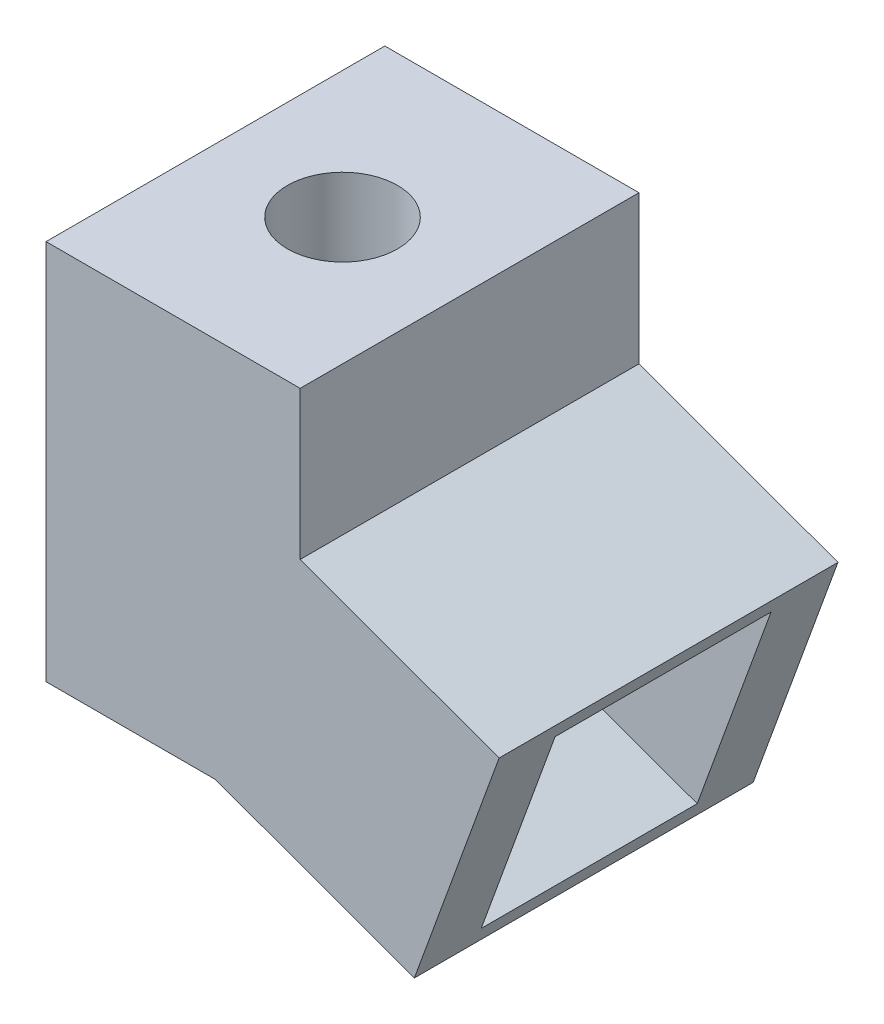
from build123d import *

# Parameters (mm, degrees)
SKETCH_1_W          = 15
SKETCH_1_H          = 5
SKETCH_1_R          = 0.85
EXTRUDE_1_DEPTH     = 2
SKETCH_2_W          = 6
SKETCH_2_H          = 8
EXTRUDE_3_DEPTH     = 6
CUT_EXTRUDE_2_DEPTH = 8
SKETCH_7_W          = 5.1
SKETCH_7_H          = 5.1
CUT_EXTRUDE_3_DEPTH = 2
SKETCH_10_W         = 8
SKETCH_10_H         = 5.852977749
SKETCH_10_W_2       = 5.1
SKETCH_10_H_2       = 5.1
EXTRUDE_4_DEPTH     = 5
SKETCH_11_W         = 6
SKETCH_11_H         = 8
EXTRUDE_5_DEPTH     = 3
CUT_EXTRUDE_4_DEPTH = 5
SKETCH_13_W         = 4.5
SKETCH_13_H         = 5
CUT_EXTRUDE_5_DEPTH = 2


with BuildPart() as part:
    # 草图1 → 凸台-拉伸1 (new body)
    with BuildSketch(Plane(origin=(0, 0, 0), x_dir=(1, 0, 0), z_dir=(0, 1, 0))):
        with Locations((7.5, 2.5)):
            Rectangle(SKETCH_1_W, SKETCH_1_H)
        with Locations(Location((3.25, 2.5, 0), (0, 0, 270))):
            Circle(SKETCH_1_R, mode=Mode.SUBTRACT)
        with Locations(Location((11.75, 2.5, 0), (0, 0, 90))):
            Circle(SKETCH_1_R, mode=Mode.SUBTRACT)
    extrude(amount=EXTRUDE_1_DEPTH)

    # 草图2 → 凸台-拉伸3 (add)
    with BuildSketch(Plane.XZ):
        with Locations((7.5, -2.5)):
            Rectangle(SKETCH_2_W, SKETCH_2_H)
    extrude(amount=EXTRUDE_3_DEPTH)

    # 草图6 → 切除-拉伸2 (cut)
    with BuildSketch(Plane(origin=(0, 0, -6.5), x_dir=(-1, 0, 0), z_dir=(0, 0, -1))):
        Polygon((-10.5, -0.5), (-10.5, -6), (-8.498163712, -6), align=None)
    extrude(amount=-CUT_EXTRUDE_2_DEPTH, mode=Mode.SUBTRACT)

    # 草图7 → 切除-拉伸3 (cut)
    with BuildSketch(Plane(origin=(9.432430229, -3.43312384, 0), x_dir=(0, 0, -1), z_dir=(0.9396926207859104, -0.3420201433256631, 0))):
        with Locations((2.5, 0.19487632)):
            Rectangle(SKETCH_7_W, SKETCH_7_H)
    extrude(amount=-CUT_EXTRUDE_3_DEPTH, mode=Mode.SUBTRACT)

    # 草图10 → 凸台-拉伸4 (add)
    with BuildSketch(Plane(origin=(9.432430229, -3.43312384, 0), x_dir=(0, 0, -1), z_dir=(0.9396926207859104, -0.3420201433256631, 0))):
        with Locations((2.5, 0.19487632)):
            Rectangle(SKETCH_10_W, SKETCH_10_H)
        with Locations((2.5, 0.19487632)):
            Rectangle(SKETCH_10_W_2, SKETCH_10_H_2, mode=Mode.SUBTRACT)
    extrude(amount=EXTRUDE_4_DEPTH)

    # 草图11 → 凸台-拉伸5 (add)
    with BuildSketch(Plane(origin=(0, 0, 0), x_dir=(1, 0, 0), z_dir=(0, 1, 0))):
        with Locations((7.5, 2.5)):
            Rectangle(SKETCH_11_W, SKETCH_11_H)
    extrude(amount=EXTRUDE_5_DEPTH)

    # 草图12 → 切除-拉伸4 (cut)
    with BuildSketch(Plane(origin=(0, 3, 0), x_dir=(1, 0, 0), z_dir=(0, 1, 0))):
        with BuildLine():
            ThreePointArc((8.8, 2.5), (7.5, 3.8), (6.2, 2.5))
            Line((6.2, 2.5), (8.8, 2.5))
        make_face()
        with BuildLine():
            Line((8.8, 2.5), (6.2, 2.5))
            ThreePointArc((6.2, 2.5), (7.5, 1.2), (8.8, 2.5))
        make_face()
    extrude(amount=-CUT_EXTRUDE_4_DEPTH, mode=Mode.SUBTRACT)

    # 草图13 → 切除-拉伸5 (cut)
    with BuildSketch(Plane(origin=(0, 2, 0), x_dir=(1, 0, 0), z_dir=(0, 1, 0))):
        with Locations((2.25, 2.5)):
            Rectangle(SKETCH_13_W, SKETCH_13_H)
        with Locations((12.75, 2.5)):
            Rectangle(SKETCH_13_W, SKETCH_13_H)
    extrude(amount=-CUT_EXTRUDE_5_DEPTH, mode=Mode.SUBTRACT)


solid = part.part
